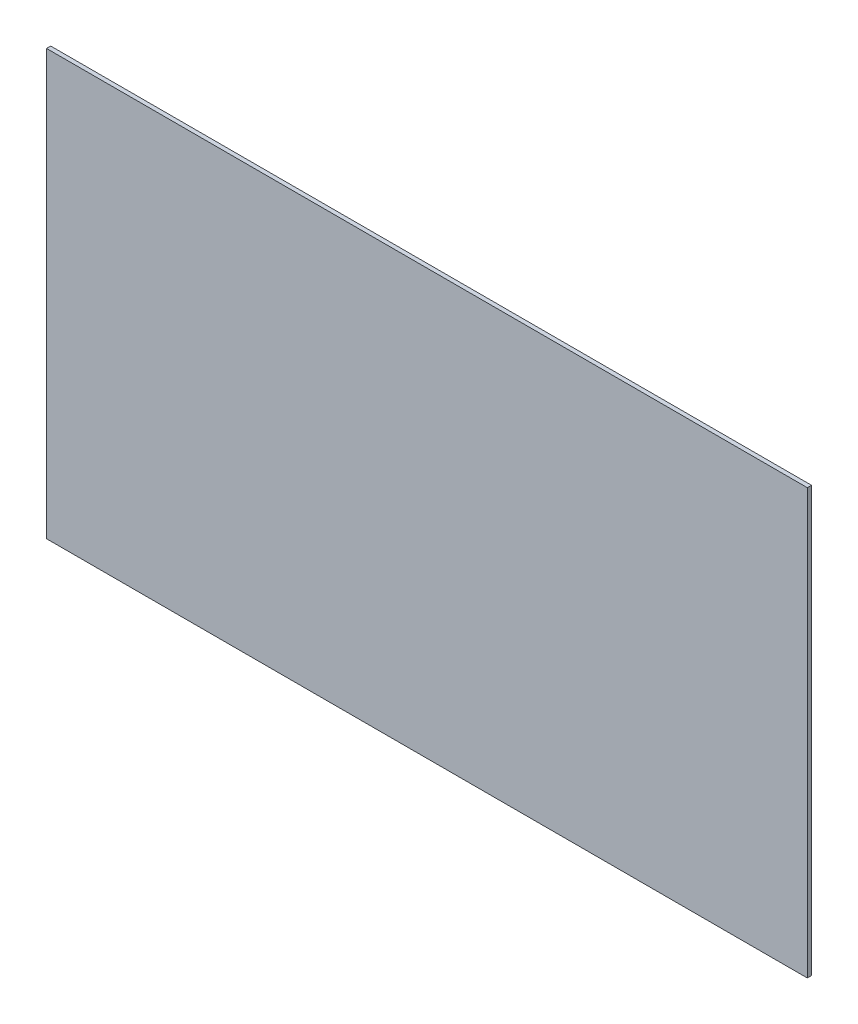
from build123d import *

# Parameters (mm, degrees)
PLAYFIELD_W             = 508
PLAYFIELD_H             = 266.7
PLAYFIELD_R             = 18.415
BOSS_EXTRUDE1_DEPTH     = 3
OUTER_BOUNDARY_W        = 546.1
OUTER_BOUNDARY_H        = 304.8
BOSS_EXTRUDE2_DEPTH     = 3
CUT_EXTRUDE1_DEPTH      = 313.715625609
CUT_EXTRUDE1_DEPTH_BACK = 313.715625609
PLAYFIELD_2_R           = 18.415
PLAYFIELD_3_W           = 508
PLAYFIELD_3_H           = 266.7
PLAYFIELD_3_R           = 18.415
CUT_EXTRUDE2_DEPTH      = 3
SKETCH1_R               = 18.415
BOSS_EXTRUDE3_DEPTH     = 3


with BuildPart() as part:
    # PlayField → Boss-Extrude1 (new body)
    with BuildSketch(Plane.XY):
        Rectangle(PLAYFIELD_W, PLAYFIELD_H)
        with Locations((-218.44, 0)):
            Circle(PLAYFIELD_R, mode=Mode.SUBTRACT)
        with Locations((218.44, 0)):
            Circle(PLAYFIELD_R, mode=Mode.SUBTRACT)
    extrude(amount=BOSS_EXTRUDE1_DEPTH)

    # Outer Boundary → Boss-Extrude2 (add)
    with BuildSketch(Plane.XY):
        Rectangle(OUTER_BOUNDARY_W, OUTER_BOUNDARY_H)
    extrude(amount=-BOSS_EXTRUDE2_DEPTH)

    # PlayField<2> → Cut-Extrude1 (cut, two sides: drawn at the far end of the back side and taken through both)
    with BuildSketch(Plane.XY.offset(-CUT_EXTRUDE1_DEPTH_BACK)):
        with Locations((-218.44, 0)):
            Circle(PLAYFIELD_2_R)
        with Locations((218.44, 0)):
            Circle(PLAYFIELD_2_R)
    extrude(amount=CUT_EXTRUDE1_DEPTH + CUT_EXTRUDE1_DEPTH_BACK, mode=Mode.SUBTRACT)

    # PlayField<3> → Cut-Extrude2 (cut)
    with BuildSketch(Plane.XY):
        Rectangle(PLAYFIELD_3_W, PLAYFIELD_3_H)
        with Locations((-218.44, 0)):
            Circle(PLAYFIELD_3_R, mode=Mode.SUBTRACT)
        with Locations((218.44, 0)):
            Circle(PLAYFIELD_3_R, mode=Mode.SUBTRACT)
    extrude(amount=CUT_EXTRUDE2_DEPTH, mode=Mode.SUBTRACT)

    # Sketch1 → Boss-Extrude3 (add)
    with BuildSketch(Plane.XY):
        with Locations((-218.44, 0)):
            Circle(SKETCH1_R)
        with Locations((218.44, 0)):
            Circle(SKETCH1_R)
    extrude(amount=-BOSS_EXTRUDE3_DEPTH)


solid = part.part
